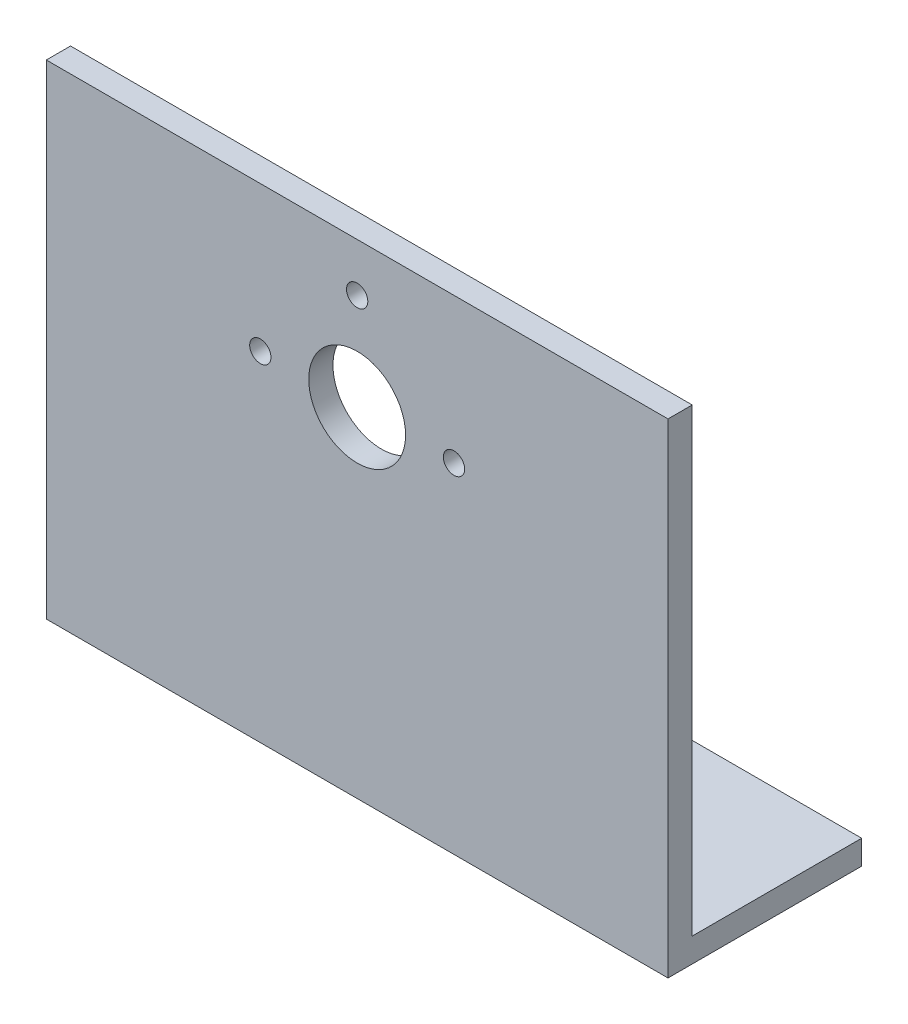
from build123d import *

# Parameters (mm, degrees)
SKETCH1_W           = 81.531554226
SKETCH1_H           = 63.5
SKETCH1_R           = 6.35
SKETCH1_R_2         = 1.397
BOSS_EXTRUDE1_DEPTH = 3.175
SKETCH2_W           = 81.531554226
SKETCH2_H           = 3.175
BOSS_EXTRUDE2_DEPTH = 22.225
SKETCH3_R           = 1.397
CUT_EXTRUDE1_DEPTH  = 3175


with BuildPart() as part:
    # Sketch1 → Boss-Extrude1 (new body)
    with BuildSketch(Plane.XY):
        with Locations((0, -12.7)):
            Rectangle(SKETCH1_W, SKETCH1_H)
        Circle(SKETCH1_R, mode=Mode.SUBTRACT)
        with Locations((0, 12.7)):
            Circle(SKETCH1_R_2, mode=Mode.SUBTRACT)
        with Locations((-12.7, 0)):
            Circle(SKETCH1_R_2, mode=Mode.SUBTRACT)
        with Locations((12.7, 0)):
            Circle(SKETCH1_R_2, mode=Mode.SUBTRACT)
    extrude(amount=BOSS_EXTRUDE1_DEPTH)

    # Sketch2 → Boss-Extrude2 (add)
    with BuildSketch(Plane(origin=(0, 0, 0), x_dir=(-1, 0, 0), z_dir=(0, 0, -1))):
        with Locations((0, -42.8625)):
            Rectangle(SKETCH2_W, SKETCH2_H)
    extrude(amount=BOSS_EXTRUDE2_DEPTH)

    # Sketch3 → Cut-Extrude1 (cut)
    with BuildSketch(Plane(origin=(0, -41.275, 0), x_dir=(1, 0, 0), z_dir=(0, 1, 0))):
        with Locations(Location((-19.05, 17.78, 0), (0, 0, 270))):
            Circle(SKETCH3_R)
        with Locations(Location((19.05, 17.78, 0), (0, 0, 270))):
            Circle(SKETCH3_R)
    extrude(amount=-CUT_EXTRUDE1_DEPTH, mode=Mode.SUBTRACT)


solid = part.part
